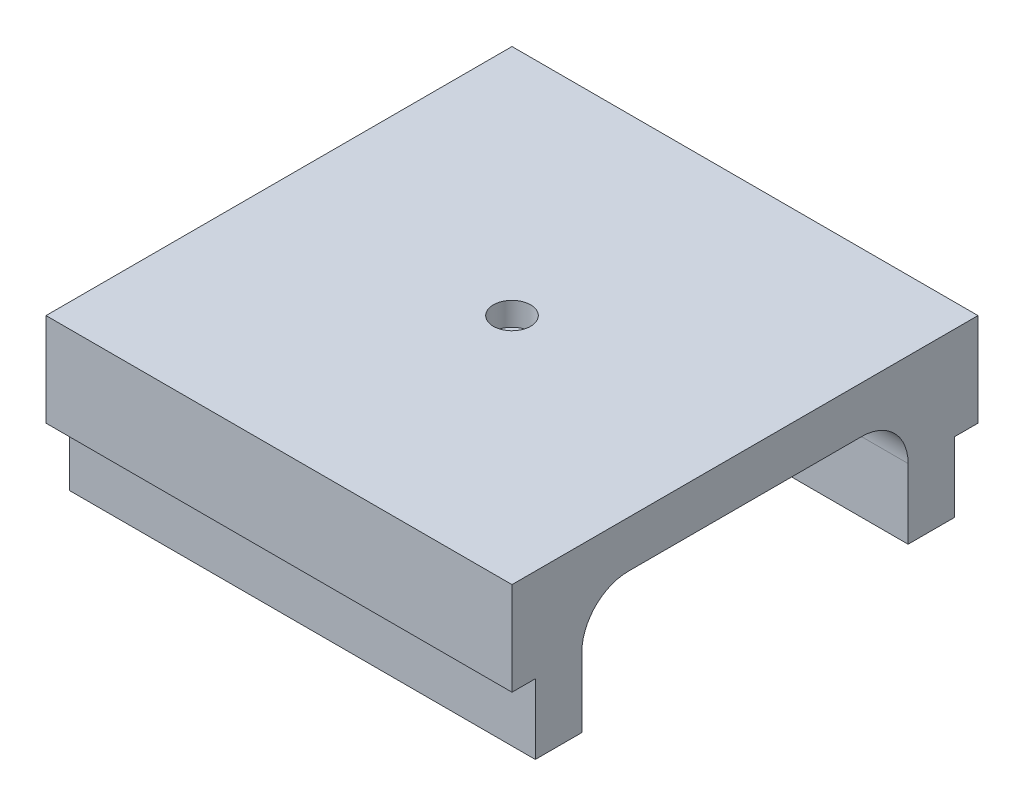
from build123d import *

# Parameters (mm, degrees)
SKETCH1_W           = 100
SKETCH1_H           = 100
BOSS_EXTRUDE1_DEPTH = 20
SKETCH3_R           = 4
CUT_EXTRUDE1_DEPTH  = 5
SKETCH4_W           = 100
SKETCH4_H           = 10
BOSS_EXTRUDE2_DEPTH = 15
SKETCH5_W           = 100
SKETCH5_H           = 70
CUT_EXTRUDE2_DEPTH  = 10
FILLET2_R           = 10
FILLET3_R           = 10
SKETCH6_W           = 5
SKETCH6_H           = 50
BOSS_EXTRUDE3_DEPTH = 8


with BuildPart() as part:
    # Sketch1 → Boss-Extrude1 (new body)
    with BuildSketch(Plane(origin=(0, 0, 0), x_dir=(1, 0, 0), z_dir=(0, 1, 0))):
        Rectangle(SKETCH1_W, SKETCH1_H)
    extrude(amount=BOSS_EXTRUDE1_DEPTH)

    # Sketch3 → Cut-Extrude1 (cut)
    with BuildSketch(Plane(origin=(0, 20, 0), x_dir=(1, 0, 0), z_dir=(0, 1, 0))):
        with Locations(Location((0, 0, 0), (0, 0, 270))):
            Circle(SKETCH3_R)
    extrude(amount=-CUT_EXTRUDE1_DEPTH, mode=Mode.SUBTRACT)

    # Sketch4 → Boss-Extrude2 (add)
    with BuildSketch(Plane.XZ):
        with Locations((0, -40)):
            Rectangle(SKETCH4_W, SKETCH4_H)
        with Locations((0, 40)):
            Rectangle(SKETCH4_W, SKETCH4_H)
    extrude(amount=BOSS_EXTRUDE2_DEPTH)

    # Sketch5 → Cut-Extrude2 (cut)
    with BuildSketch(Plane.XZ):
        Rectangle(SKETCH5_W, SKETCH5_H)
    extrude(amount=-CUT_EXTRUDE2_DEPTH, mode=Mode.SUBTRACT)

    # Fillet2
    fillet2_edges = [part.edges().sort_by_distance(p)[0] for p in [
        (0, 10, -35),
    ]]
    fillet(fillet2_edges, radius=FILLET2_R)

    # Fillet3
    fillet3_edges = [part.edges().sort_by_distance(p)[0] for p in [
        (0, 10, 35),
    ]]
    fillet(fillet3_edges, radius=FILLET3_R)

    # Sketch6 → Boss-Extrude3 (add)
    with BuildSketch(Plane.XZ.offset(-10)):
        with Locations((-32.5, 0)):
            Rectangle(SKETCH6_W, SKETCH6_H)
    extrude(amount=BOSS_EXTRUDE3_DEPTH)


solid = part.part
